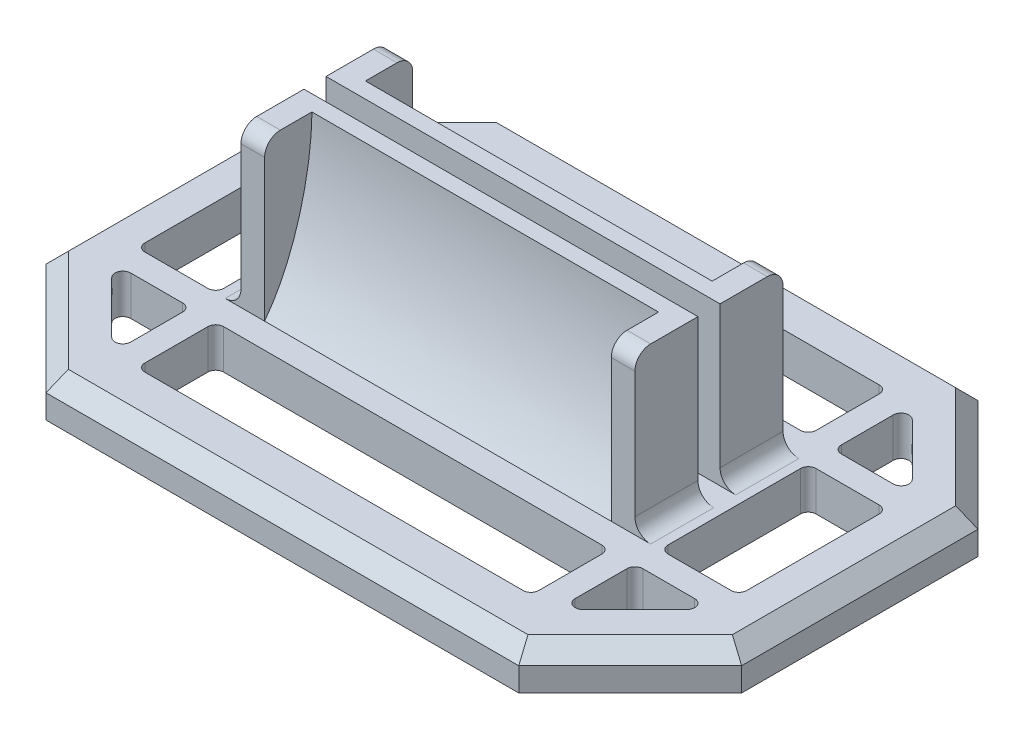
from build123d import *

# Parameters (mm, degrees)
BOSS_EXTRUDE1_DEPTH     = 6.35
SKETCH2_W               = 63.5
SKETCH2_H               = 10.16
BOSS_EXTRUDE2_DEPTH     = 25.4
SKETCH2_3_W             = 63.5
SKETCH2_3_H             = 12.7
SKETCH2_3_W_2           = 12.7
SKETCH2_3_H_2           = 23.876
CUT_EXTRUDE2_DEPTH      = 72.817261499
CUT_EXTRUDE1_DEPTH      = 27.94
CUT_EXTRUDE1_DEPTH_BACK = 27.94
FILLET1_R               = 2.54
CHAMFER1_SIZE           = 2.54
FILLET2_R               = 2.54
FILLET3_R               = 1.27


with BuildPart() as part:
    # Sketch1 → Boss-Extrude1 (new body)
    with BuildSketch(Plane(origin=(0, 0, 0), x_dir=(1, 0, 0), z_dir=(0, 1, 0))):
        Polygon((-38.1, 37.010512242), (38.1, 37.010512242), (56.060512242, 19.05), (56.060512242, -19.05), (38.1, -37.010512242), (-38.1, -37.010512242), (-56.060512242, -19.05), (-56.060512242, 19.05), align=None)
    extrude(amount=BOSS_EXTRUDE1_DEPTH)

    # Sketch2 → Boss-Extrude2 (add)
    with BuildSketch(Plane(origin=(0, 6.35, 0), x_dir=(1, 0, 0), z_dir=(0, 1, 0))):
        with Locations((0, 6.858)):
            Rectangle(SKETCH2_W, SKETCH2_H)
        with Locations((0, -6.858)):
            Rectangle(SKETCH2_W, SKETCH2_H)
    extrude(amount=BOSS_EXTRUDE2_DEPTH)

    # Sketch2<3> → Cut-Extrude2 (cut, through all)
    with BuildSketch(Plane(origin=(0, 6.35, 0), x_dir=(1, 0, 0), z_dir=(0, 1, 0))):
        Polygon((48.514, -16.002), (35.810678974, -16.002), (35.810678974, -28.702), align=None)
        with Locations((0, -22.352)):
            Rectangle(SKETCH2_3_W, SKETCH2_3_H)
        with Locations((0, 22.352)):
            Rectangle(SKETCH2_3_W, SKETCH2_3_H)
        with Locations((42.164, 0)):
            Rectangle(SKETCH2_3_W_2, SKETCH2_3_H_2)
        with Locations((-42.164, 0)):
            Rectangle(SKETCH2_3_W_2, SKETCH2_3_H_2)
        Polygon((48.514, 16.002), (35.814, 28.702), (35.814, 16.002), align=None)
        Polygon((-48.514, 16.002), (-35.814, 16.002), (-35.814, 28.702), align=None)
        Polygon((-48.514, -16.002), (-35.814, -28.702), (-35.814, -16.002), align=None)
    extrude(amount=-CUT_EXTRUDE2_DEPTH, mode=Mode.SUBTRACT)

    # Sketch3 → Cut-Extrude1 (cut, two sides: drawn at the far end of the back side and taken through both)
    with BuildSketch(Plane(origin=(0, 0, 0), x_dir=(0, 0, -1), z_dir=(1, 0, 0)).offset(-CUT_EXTRUDE1_DEPTH_BACK)):
        with BuildLine():
            Line((-11.938, 31.75), (-4.318, 31.75))
            add(Edge.make_bspline(
                [(-11.938, 6.35), (-6.879920458, 12.89035907), (-4.318, 23.963686989), (-4.318, 31.75)],
                knots=[0, 0, 0, 0, 1, 1, 1, 1], degree=3))
            Line((-11.938, 6.35), (-11.938, 31.75))
        make_face()
        with BuildLine():
            Line((11.938, 6.35), (11.938, 31.75))
            Line((11.938, 31.75), (4.318, 31.75))
            add(Edge.make_bspline(
                [(4.318, 31.75), (4.318, 21.978725734), (6.879920458, 14.349731609), (11.938, 6.35)],
                knots=[0, 0, 0, 0, 1, 1, 1, 1], degree=3))
        make_face()
    extrude(amount=CUT_EXTRUDE1_DEPTH + CUT_EXTRUDE1_DEPTH_BACK, mode=Mode.SUBTRACT)

    # Fillet1
    fillet1_edges = [part.edges().sort_by_distance(p)[0] for p in [
        (-29.845, 31.75, 11.938),
        (-29.845, 31.75, -11.938),
        (29.845, 31.75, 11.938),
        (29.845, 31.75, -11.938),
    ]]
    fillet(fillet1_edges, radius=FILLET1_R)

    # Chamfer1
    chamfer1_edges = [part.edges().sort_by_distance(p)[0] for p in [
        (-47.080256121, 6.35, -28.030256121),
        (-56.060512242, 6.35, 0),
        (-47.080256121, 6.35, 28.030256121),
        (0, 6.35, 37.010512242),
        (47.080256121, 6.35, 28.030256121),
        (56.060512242, 6.35, 0),
        (47.080256121, 6.35, -28.030256121),
        (0, 6.35, -37.010512242),
    ]]
    chamfer(chamfer1_edges, length=CHAMFER1_SIZE)

    # Fillet2
    fillet2_edges = [part.edges().sort_by_distance(p)[0] for p in [
        (31.75, 6.35, 6.858),
        (-31.75, 6.35, 6.858),
        (-31.75, 6.35, -6.858),
        (31.75, 6.35, -6.858),
    ]]
    fillet(fillet2_edges, radius=FILLET2_R)

    # Fillet3
    fillet3_edges = [part.edges().sort_by_distance(p)[0] for p in [
        (-31.75, 3.175, -16.002),
        (-31.75, 3.175, -28.702),
        (31.75, 3.175, -16.002),
        (31.75, 3.175, -28.702),
        (35.814, 3.175, -16.002),
        (35.814, 3.175, -28.702),
        (48.514, 3.175, -16.002),
        (48.514, 3.175, 11.938),
        (35.814, 3.175, 11.938),
        (35.814, 3.175, -11.938),
        (48.514, 3.175, -11.938),
        (-35.814, 3.175, -28.702),
        (-35.814, 3.175, -16.002),
        (-48.514, 3.175, -16.002),
        (-48.514, 3.175, 11.938),
        (-48.514, 3.175, -11.938),
        (-35.814, 3.175, -11.938),
        (-35.814, 3.175, 11.938),
        (-48.514, 3.175, 16.002),
        (-35.814, 3.175, 16.002),
        (-35.814, 3.175, 28.702),
        (-31.75, 3.175, 28.702),
        (-31.75, 3.175, 16.002),
        (31.75, 3.175, 16.002),
        (31.75, 3.175, 28.702),
        (35.810678974, 3.175, 28.702),
        (35.810678974, 3.175, 16.002),
        (48.514, 3.175, 16.002),
    ]]
    fillet(fillet3_edges, radius=FILLET3_R)


solid = part.part
